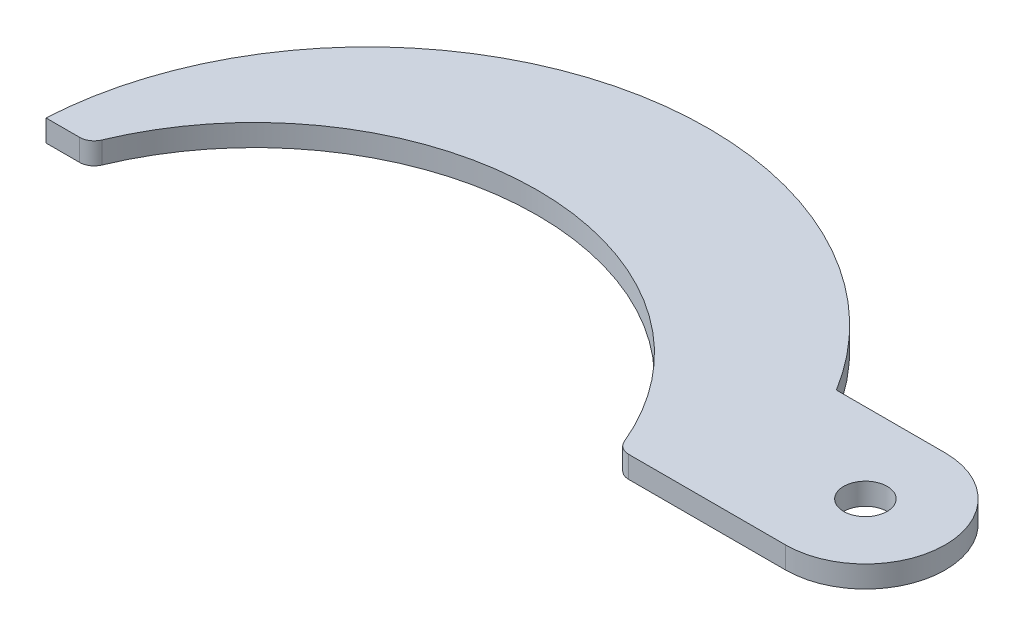
from build123d import *

# Parameters (mm, degrees)
CROQUIS1_R              = 3
SALIENTE_EXTRUIR1_DEPTH = 3
REDONDEO1_R             = 2
REDONDEO2_R             = 2


with BuildPart() as part:
    # Croquis1 → Saliente-Extruir1 (new body)
    with BuildSketch(Plane(origin=(0, 0, 0), x_dir=(1, 0, 0), z_dir=(0, 1, 0))):
        with BuildLine():
            Line((59.968853779, -6.466358732), (82.968853779, -6.466358732))
            ThreePointArc((82.968853779, -6.466358732), (93.968853779, 4.533641268), (82.968853779, 15.533641268))
            Line((82.968853779, 15.533641268), (67.968853779, 15.533641268))
            ThreePointArc((67.968853779, 15.533641268), (16.376491879, 36.535254234), (-19.031146221, -6.466358732))
            Line((-19.031146221, -6.466358732), (-13.031146221, -6.466358732))
            ThreePointArc((-13.031146221, -6.466358732), (23.468853779, 18.795009604), (59.968853779, -6.466358732))
        make_face()
        with Locations(Location((82.968853779, 4.533641268, 0), (0, 0, 270))):
            Circle(CROQUIS1_R, mode=Mode.SUBTRACT)
    extrude(amount=SALIENTE_EXTRUIR1_DEPTH)

    # Redondeo1
    redondeo1_edges = [part.edges().sort_by_distance(p)[0] for p in [
        (59.968853779, 1.5, 6.466358732),
    ]]
    fillet(redondeo1_edges, radius=REDONDEO1_R)

    # Redondeo2
    redondeo2_edges = [part.edges().sort_by_distance(p)[0] for p in [
        (-13.031146221, 1.5, 6.466358732),
    ]]
    fillet(redondeo2_edges, radius=REDONDEO2_R)


solid = part.part
